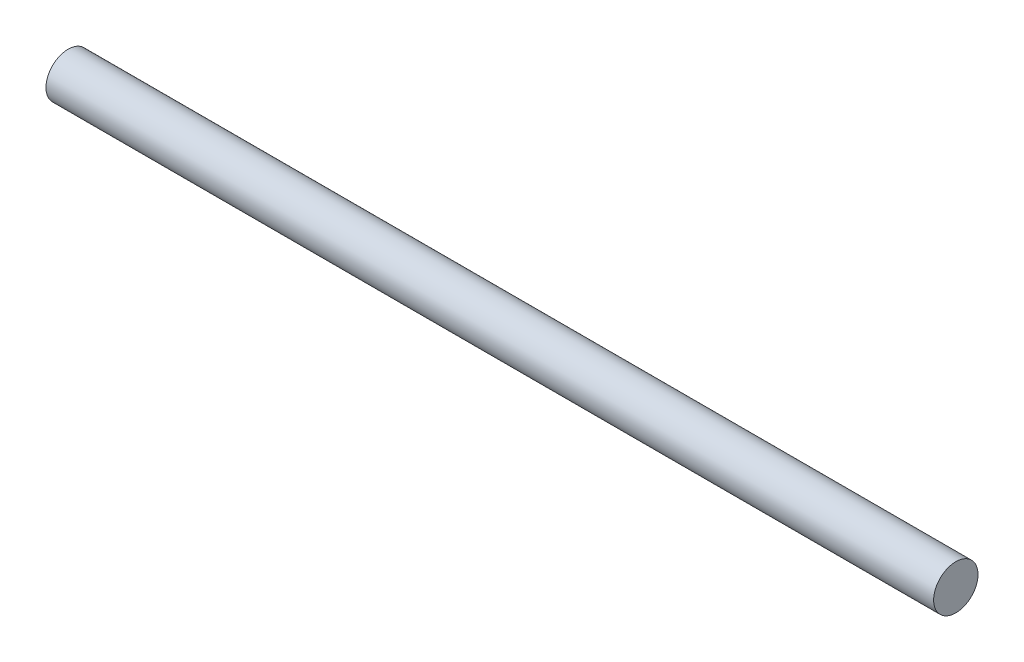
from build123d import *

# Parameters (mm, degrees)
ESQUISSE1_R        = 1
BOSS_EXTRU_1_DEPTH = 40


with BuildPart() as part:
    # Esquisse1 → Boss.-Extru.1 (new body)
    with BuildSketch(Plane(origin=(0, 0, 0), x_dir=(0, 0, -1), z_dir=(1, 0, 0))):
        Circle(ESQUISSE1_R)
    extrude(amount=BOSS_EXTRU_1_DEPTH)


solid = part.part
